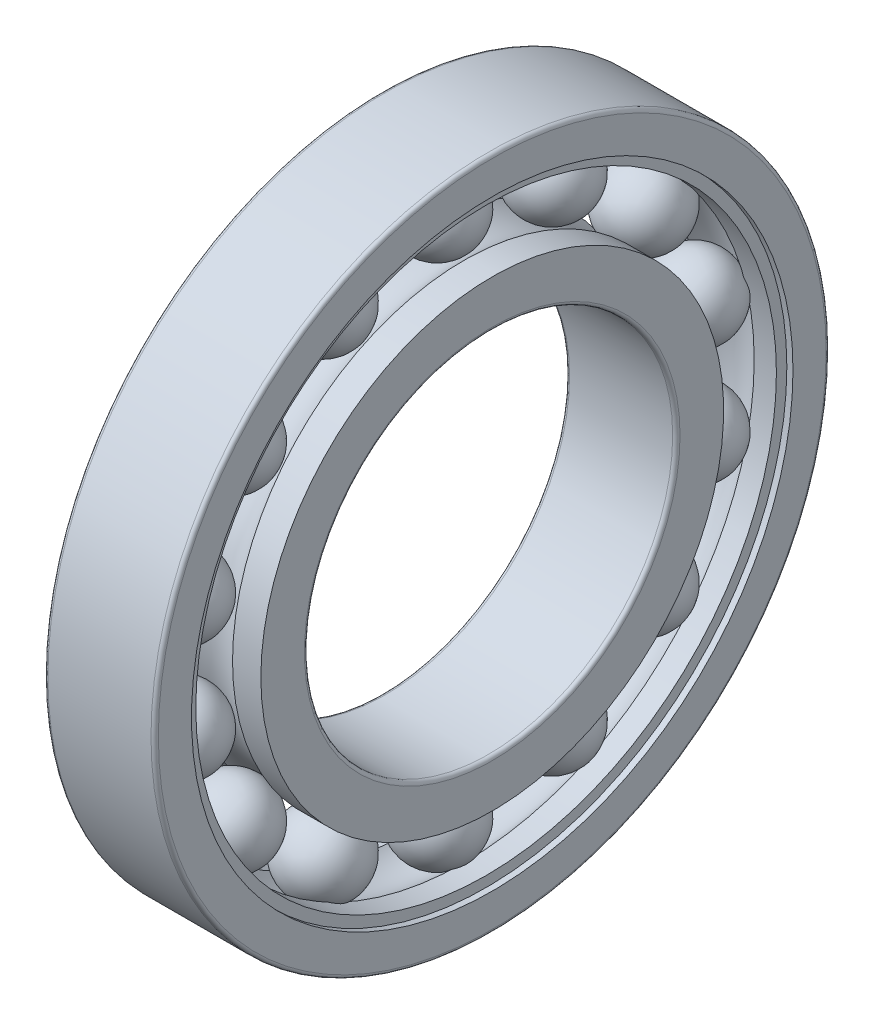
from build123d import *

# Parameters (mm, degrees)
SKETCH2_R          = 24.5
SKETCH2_R_2        = 23.65
CUT_EXTRUDE1_DEPTH = 0.5
FILLET1_R          = 0.3
FILLET2_R          = 0.3
CIRPATTERN4_COUNT  = 14


with BuildPart() as part:
    # Sketch1 → Revolve1 (revolve)
    with BuildSketch(Plane.XY, mode=Mode.PRIVATE) as revolve1_sk:
        with BuildLine():
            Line((4.5, 23.65), (4.5, 27.5))
            Line((4.5, 27.5), (-4.5, 27.5))
            Line((-4.5, 27.5), (-4.5, 23.65))
            Line((-4.5, 23.65), (-2.1914607, 23.65))
            ThreePointArc((-2.1914607, 23.65), (0, 24.5), (2.1914607, 23.65))
            Line((2.1914607, 23.65), (4.5, 23.65))
        make_face()
        with BuildLine():
            ThreePointArc((2.1914607, 18.85), (0, 18), (-2.1914607, 18.85))
            Line((-2.1914607, 18.85), (-4.5, 18.85))
            Line((-4.5, 18.85), (-4.5, 15))
            Line((-4.5, 15), (4.5, 15))
            Line((4.5, 15), (4.5, 18.85))
            Line((4.5, 18.85), (2.1914607, 18.85))
        make_face()
    revolve(revolve1_sk.sketch.rotate(Axis((0, 0, 0), (1, 0, 0)), 90), axis=Axis((0, 0, 0), (1, 0, 0)))

    # Sketch2 → Cut-Extrude1 (cut)
    with BuildSketch(Plane(origin=(4.5, 0, 0), x_dir=(0, 0, -1), z_dir=(1, 0, 0))):
        Circle(SKETCH2_R)
        with Locations(Location((0, 0, 0), (0, 0, 180))):
            Circle(SKETCH2_R_2, mode=Mode.SUBTRACT)
    cut_extrude1 = extrude(amount=-CUT_EXTRUDE1_DEPTH, mode=Mode.SUBTRACT)

    # Mirror1: Cut-Extrude1 across plane
    add(cut_extrude1.mirror(Plane(origin=(0, 0, 0), x_dir=(0, 0, 1), z_dir=(1, 0, 0))), mode=Mode.SUBTRACT)

    # Fillet1
    fillet1_edges = [part.edges().sort_by_distance(p)[0] for p in [
        (-4.5, 0, -27.5),
        (4.5, 0, -27.5),
    ]]
    fillet(fillet1_edges, radius=FILLET1_R)

    # Fillet2
    fillet2_edges = [part.edges().sort_by_distance(p)[0] for p in [
        (4.5, 0, -15),
        (-4.5, 0, -15),
    ]]
    fillet(fillet2_edges, radius=FILLET2_R)


with BuildPart() as body_2:
    # Sketch3 → Revolve2 (revolve)
    with BuildSketch(Plane.XY):
        with BuildLine():
            Line((-3.225, 21.5), (3.225, 21.5))
            ThreePointArc((3.225, 21.5), (0, 24.725), (-3.225, 21.5))
        make_face()
    revolve(axis=Axis((-3.225, 21.5, 0), (1, 0, 0)))


with BuildPart() as cirpattern4_1:
    # CirPattern4: pattern copy
    add(body_2.part.rotate(Axis((0, 0, 0), (1, 0, 0)), 1 * 360 / CIRPATTERN4_COUNT))


with BuildPart() as cirpattern4_2:
    # CirPattern4: pattern copy
    add(body_2.part.rotate(Axis((0, 0, 0), (1, 0, 0)), 2 * 360 / CIRPATTERN4_COUNT))


with BuildPart() as cirpattern4_3:
    # CirPattern4: pattern copy
    add(body_2.part.rotate(Axis((0, 0, 0), (1, 0, 0)), 3 * 360 / CIRPATTERN4_COUNT))


with BuildPart() as cirpattern4_4:
    # CirPattern4: pattern copy
    add(body_2.part.rotate(Axis((0, 0, 0), (1, 0, 0)), 4 * 360 / CIRPATTERN4_COUNT))


with BuildPart() as cirpattern4_5:
    # CirPattern4: pattern copy
    add(body_2.part.rotate(Axis((0, 0, 0), (1, 0, 0)), 5 * 360 / CIRPATTERN4_COUNT))


with BuildPart() as cirpattern4_6:
    # CirPattern4: pattern copy
    add(body_2.part.rotate(Axis((0, 0, 0), (1, 0, 0)), 6 * 360 / CIRPATTERN4_COUNT))


with BuildPart() as cirpattern4_7:
    # CirPattern4: pattern copy
    add(body_2.part.rotate(Axis((0, 0, 0), (1, 0, 0)), 7 * 360 / CIRPATTERN4_COUNT))


with BuildPart() as cirpattern4_8:
    # CirPattern4: pattern copy
    add(body_2.part.rotate(Axis((0, 0, 0), (1, 0, 0)), 8 * 360 / CIRPATTERN4_COUNT))


with BuildPart() as cirpattern4_9:
    # CirPattern4: pattern copy
    add(body_2.part.rotate(Axis((0, 0, 0), (1, 0, 0)), 9 * 360 / CIRPATTERN4_COUNT))


with BuildPart() as cirpattern4_10:
    # CirPattern4: pattern copy
    add(body_2.part.rotate(Axis((0, 0, 0), (1, 0, 0)), 10 * 360 / CIRPATTERN4_COUNT))


with BuildPart() as cirpattern4_11:
    # CirPattern4: pattern copy
    add(body_2.part.rotate(Axis((0, 0, 0), (1, 0, 0)), 11 * 360 / CIRPATTERN4_COUNT))


with BuildPart() as cirpattern4_12:
    # CirPattern4: pattern copy
    add(body_2.part.rotate(Axis((0, 0, 0), (1, 0, 0)), 12 * 360 / CIRPATTERN4_COUNT))


with BuildPart() as cirpattern4_13:
    # CirPattern4: pattern copy
    add(body_2.part.rotate(Axis((0, 0, 0), (1, 0, 0)), 13 * 360 / CIRPATTERN4_COUNT))


solid = Compound([part.part, body_2.part, cirpattern4_1.part, cirpattern4_2.part, cirpattern4_3.part, cirpattern4_4.part, cirpattern4_5.part, cirpattern4_6.part, cirpattern4_7.part, cirpattern4_8.part, cirpattern4_9.part, cirpattern4_10.part, cirpattern4_11.part, cirpattern4_12.part, cirpattern4_13.part])
